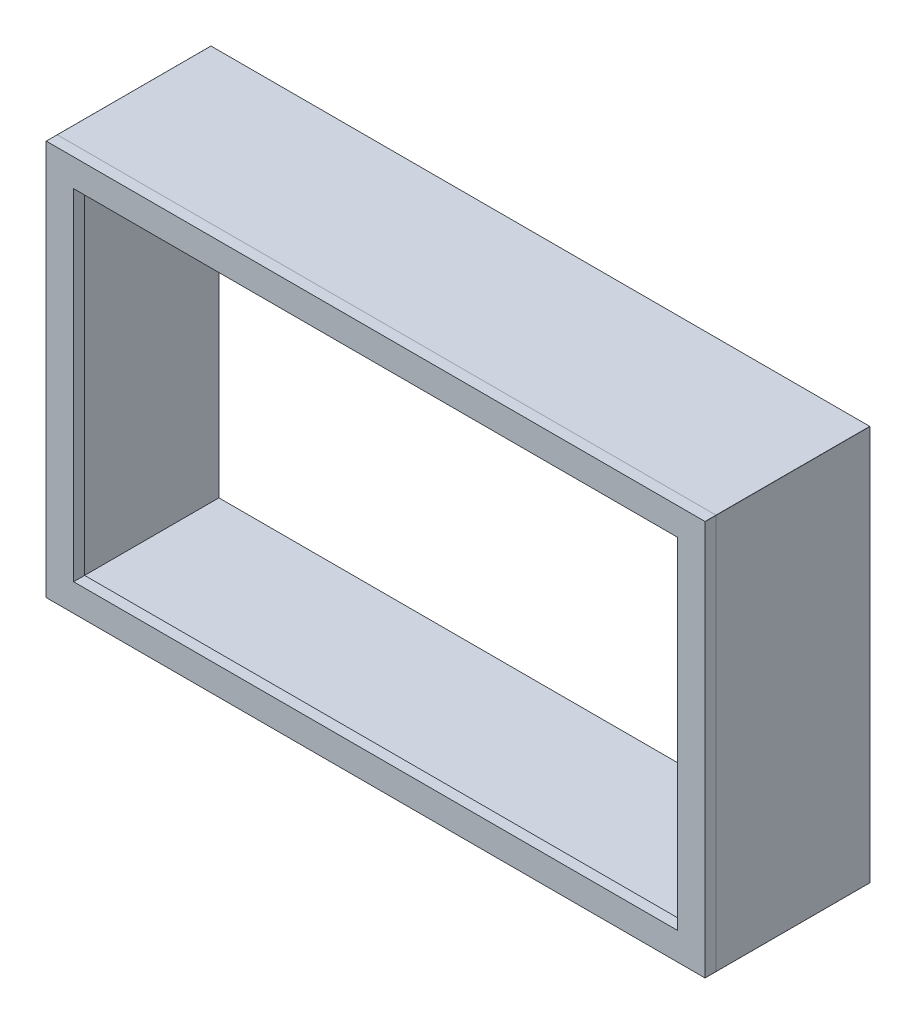
from build123d import *

# Parameters (mm, degrees)
EXTRUDE_THIN1_DEPTH      = 203.2
EXTRUDE_THIN1_DEPTH_BACK = 152.4
SKETCH1_W                = 1486.916
SKETCH1_H                = 877.316
SKETCH2_W                = 1397
SKETCH2_H                = 787.4
EXTRUDE_THIN2_DEPTH      = 25.4


with BuildPart() as part:
    # Sketch1 → Extrude-Thin1 (new, two sides: drawn at the far end of the back side and taken through both)
    with BuildSketch(Plane.XY.offset(-EXTRUDE_THIN1_DEPTH_BACK)):
        with BuildLine():
            Line((-761.746, 457.2), (761.746, 457.2))
            ThreePointArc((761.746, 457.2), (761.925605122, 457.125605122), (762, 456.946))
            Line((762, 456.946), (762, -456.946))
            ThreePointArc((762, -456.946), (761.925605123, -457.125605122), (761.746, -457.2))
            Line((761.746, -457.2), (-761.746, -457.2))
            ThreePointArc((-761.746, -457.2), (-761.925605123, -457.125605123), (-762, -456.946))
            Line((-762, -456.946), (-762, 456.946))
            ThreePointArc((-762, 456.946), (-761.925605123, 457.125605123), (-761.746, 457.2))
        make_face()
        Rectangle(SKETCH1_W, SKETCH1_H, mode=Mode.SUBTRACT)
    extrude(amount=EXTRUDE_THIN1_DEPTH + EXTRUDE_THIN1_DEPTH_BACK)


with BuildPart() as body_2:
    # Sketch2 → Extrude-Thin2 (new body)
    with BuildSketch(Plane.XY.offset(203.2)):
        with BuildLine():
            Line((-762, 456.946), (-762, -456.946))
            ThreePointArc((-762, -456.946), (-761.925605123, -457.125605122), (-761.746, -457.2))
            Line((-761.746, -457.2), (761.746, -457.2))
            ThreePointArc((761.746, -457.2), (761.925605123, -457.125605122), (762, -456.946))
            Line((762, -456.946), (762, 456.946))
            ThreePointArc((762, 456.946), (761.925605122, 457.125605122), (761.746, 457.2))
            Line((761.746, 457.2), (-761.746, 457.2))
            ThreePointArc((-761.746, 457.2), (-761.925605123, 457.125605123), (-762, 456.946))
        make_face()
        Rectangle(SKETCH2_W, SKETCH2_H, mode=Mode.SUBTRACT)
    extrude(amount=EXTRUDE_THIN2_DEPTH)


solid = Compound([part.part, body_2.part])
